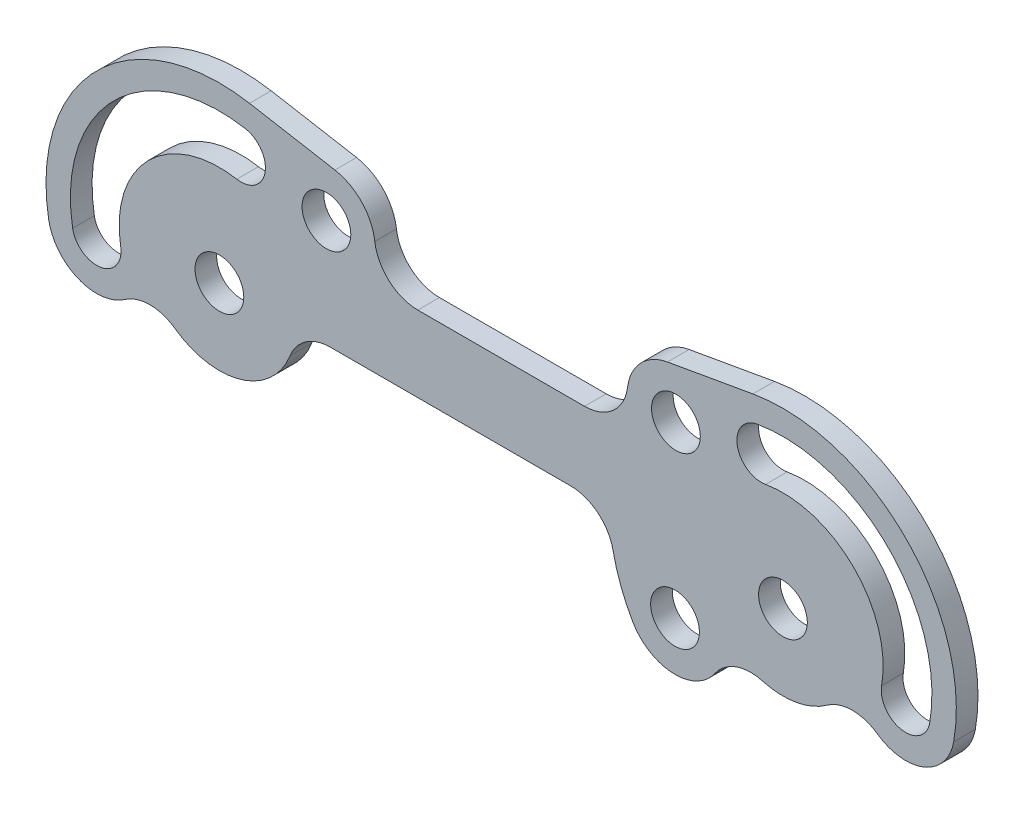
from build123d import *

# Parameters (mm, degrees)
SKETCH1_R           = 1.7859375
BOSS_EXTRUDE1_DEPTH = 1.5875
FILLET1_R           = 3.175


with BuildPart() as part:
    # Sketch1 → Boss-Extrude1 (new body)
    with BuildSketch(Plane.XY):
        with BuildLine():
            ThreePointArc((33.144558463, -2.205331856), (29.617756121, 8.980256121), (18.432168144, 12.507058463))
            Line((18.432168144, 12.507058463), (12.178638912, 11.404392535))
            ThreePointArc((12.178638912, 11.404392535), (9.43473159, 9.087090354), (10.092061938, 5.55625))
            Line((10.092061938, 5.55625), (-10.092061938, 5.55625))
            ThreePointArc((-10.092061938, 5.55625), (-9.43473159, 9.087090354), (-12.178638912, 11.404392535))
            Line((-12.178638912, 11.404392535), (-18.432168144, 12.507058463))
            ThreePointArc((-18.432168144, 12.507058463), (-29.617756121, 8.980256121), (-33.144558463, -2.205331856))
            ThreePointArc((-33.144558463, -2.205331856), (-29.006698655, -5.102692459), (-26.109338088, -0.964832626))
            ThreePointArc((-26.109338088, -0.964832626), (-20.153240935, -5.535106794), (-15.08125, 0))
            Line((-15.08125, 0), (7.9375, 0))
            ThreePointArc((7.9375, 0), (8.370242006, -3.287001873), (9.638977372, -6.35))
            ThreePointArc((9.638977372, -6.35), (14.51824938, -7.657396978), (15.825646329, -2.778124963))
            ThreePointArc((15.825646329, -2.778124963), (21.602332634, -5.471838087), (26.109338066, -0.964832752))
            ThreePointArc((26.109338066, -0.964832752), (29.006698718, -5.10269247), (33.144558463, -2.205331856))
        make_face()
        with Locations((-20.6375, 0)):
            Circle(SKETCH1_R, mode=Mode.SUBTRACT)
        with Locations((12.732311861, -4.5640625)):
            Circle(SKETCH1_R, mode=Mode.SUBTRACT)
        with Locations((20.6375, 0)):
            Circle(SKETCH1_R, mode=Mode.SUBTRACT)
        with BuildLine():
            ThreePointArc((-31.385753367, -1.895207064), (-28.354907604, 7.717407604), (-18.742292936, 10.748253367))
            ThreePointArc((-18.742292936, 10.748253367), (-17.293612632, 8.679323478), (-19.362542521, 7.230643174))
            ThreePointArc((-19.362542521, 7.230643174), (-25.82921057, 5.19171057), (-27.868143174, -1.274957479))
            ThreePointArc((-27.868143174, -1.274957479), (-29.316823478, -3.343887368), (-31.385753367, -1.895207064))
        make_face(mode=Mode.SUBTRACT)
        with Locations((-12.798888497, 7.886782342)):
            Circle(SKETCH1_R, mode=Mode.SUBTRACT)
        with BuildLine():
            ThreePointArc((18.742292936, 10.748253367), (28.354907604, 7.717407604), (31.385753367, -1.895207064))
            ThreePointArc((31.385753367, -1.895207064), (29.316823478, -3.343887368), (27.868143174, -1.274957479))
            ThreePointArc((27.868143174, -1.274957479), (25.82921057, 5.19171057), (19.362542521, 7.230643174))
            ThreePointArc((19.362542521, 7.230643174), (17.293612632, 8.679323478), (18.742292936, 10.748253367))
        make_face(mode=Mode.SUBTRACT)
        with Locations((12.798888497, 7.886782342)):
            Circle(SKETCH1_R, mode=Mode.SUBTRACT)
    extrude(amount=BOSS_EXTRUDE1_DEPTH)

    # Fillet1
    fillet1_edges = [part.edges().sort_by_distance(p)[0] for p in [
        (26.109338066, -0.964832752, 0.79375),
        (15.825646329, -2.778124963, 0.79375),
        (7.9375, 0, 0.79375),
        (-15.08125, 0, 0.79375),
        (-26.109338088, -0.964832626, 0.79375),
        (-10.092061938, 5.55625, 0.79375),
        (10.092061938, 5.55625, 0.79375),
    ]]
    fillet(fillet1_edges, radius=FILLET1_R)


solid = part.part
